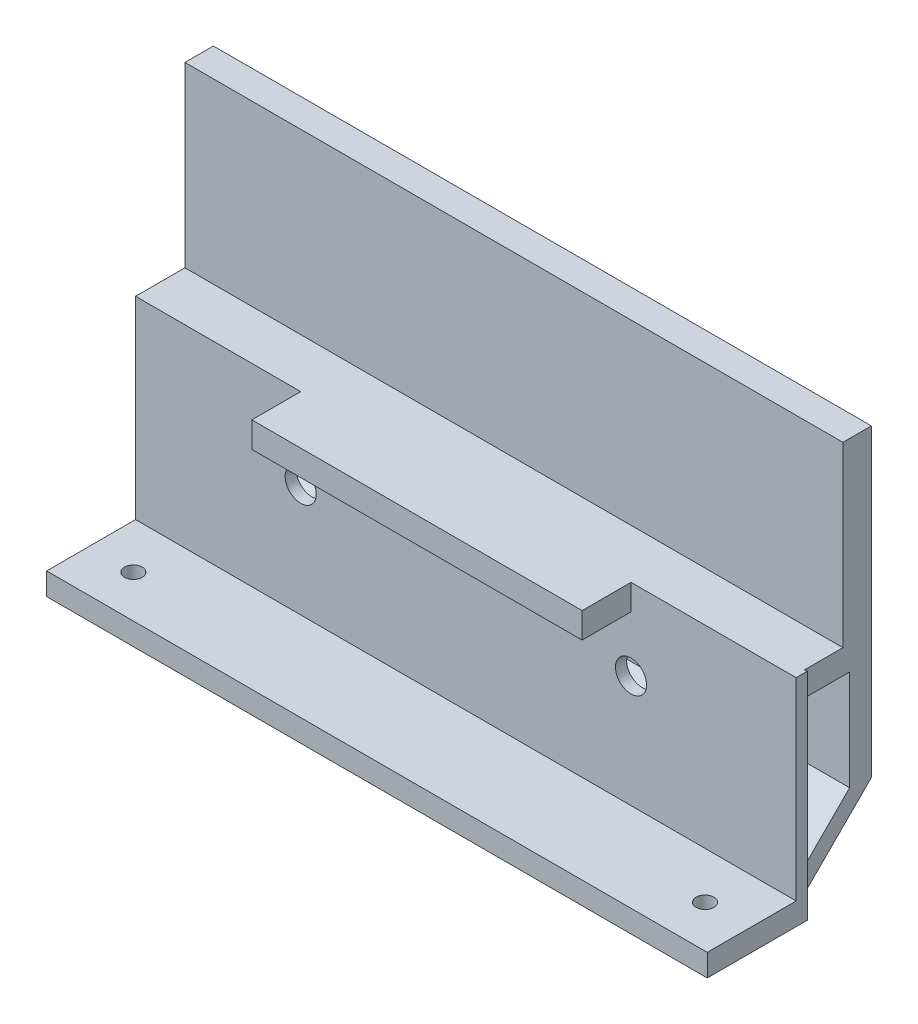
from build123d import *

# Parameters (mm, degrees)
ESQUISSE1_W             = 148.59
ESQUISSE1_H             = 2.5
ESQUISSE1_H_2           = 20
BOSS_EXTRU_2_DEPTH      = 5
BOSS_EXTRU_4_DEPTH      = 0.001
BOSS_EXTRU_4_DEPTH_BACK = 2.5
ESQUISSE2_W             = 148.59
ESQUISSE2_H             = 43.5
ESQUISSE3_R             = 2
ENL_V_MAT_EXTRU_1_DEPTH = 5
BOSS_EXTRU_9_DEPTH      = 148
ENL_V_MAT_EXTRU_2_DEPTH = 148
ENL_V_MAT_EXTRU_3_DEPTH = 158
ESQUISSE7_W             = 74.295
ESQUISSE7_H             = 5.75
BOSS_EXTRU_10_DEPTH     = 11
ESQUISSE8_W             = 148
ESQUISSE8_H             = 6.4
BOSS_EXTRU_11_DEPTH     = 40


with BuildPart() as part:
    # Esquisse1 → Boss.-Extru.2 (new body)
    with BuildSketch(Plane(origin=(0, 0, 0), x_dir=(1, 0, 0), z_dir=(0, 1, 0))):
        with Locations((-5.161134174, 17.745562161)):
            Rectangle(ESQUISSE1_W, ESQUISSE1_H)
        with Locations((-5.161134174, 28.995562161)):
            Rectangle(ESQUISSE1_W, ESQUISSE1_H_2)
    extrude(amount=BOSS_EXTRU_2_DEPTH)

    # Esquisse2 → Boss.-Extru.4 (add, two sides: drawn at the far end of the back side and taken through both)
    with BuildSketch(Plane(origin=(0, 0, -38.995562161), x_dir=(-1, 0, 0), z_dir=(0, 0, -1)).offset(-BOSS_EXTRU_4_DEPTH_BACK)):
        with Locations((5.161134174, 26.75)):
            Rectangle(ESQUISSE2_W, ESQUISSE2_H)
    extrude(amount=BOSS_EXTRU_4_DEPTH + BOSS_EXTRU_4_DEPTH_BACK)

    # Esquisse3 → Enlèv. mat.-Extru.1 (cut)
    with BuildSketch(Plane.XZ):
        with Locations(Location((-69.456134174, -25.995562161, 0), (0, 0, 270))):
            Circle(ESQUISSE3_R)
        with Locations(Location((59.133865826, -25.995562161, 0), (0, 0, 270))):
            Circle(ESQUISSE3_R)
    extrude(amount=-ENL_V_MAT_EXTRU_1_DEPTH, mode=Mode.SUBTRACT)

    # Esquisse4 → Boss.-Extru.9 (add)
    with BuildSketch(Plane.ZY.offset(79.456134174)):
        Polygon((-38.996562161, 5), (-38.996562161, 48.5), (-53.996562161, 48.5), (-53.996562161, 20), align=None)
    extrude(amount=-BOSS_EXTRU_9_DEPTH)

    # Esquisse5 → Enlèv. mat.-Extru.2 (cut)
    with BuildSketch(Plane.XY.offset(-36.495562161)):
        with BuildLine():
            ThreePointArc((31.986365826, 33.75), (28.486365826, 30.25), (31.986365826, 26.75))
            Line((31.986365826, 26.75), (31.986365826, 33.75))
        make_face()
        with BuildLine():
            Line((31.986365826, 33.75), (31.986365826, 26.75))
            ThreePointArc((31.986365826, 26.75), (34.46123956, 27.775126266), (35.486365826, 30.25))
            ThreePointArc((35.486365826, 30.25), (34.46123956, 32.724873734), (31.986365826, 33.75))
        make_face()
        with BuildLine():
            ThreePointArc((-38.808634174, 30.25), (-39.83376044, 32.724873734), (-42.308634174, 33.75))
            Line((-42.308634174, 33.75), (-42.308634174, 26.75))
            ThreePointArc((-42.308634174, 26.75), (-39.83376044, 27.775126266), (-38.808634174, 30.25))
        make_face()
        with BuildLine():
            Line((-42.308634174, 26.75), (-42.308634174, 33.75))
            ThreePointArc((-42.308634174, 33.75), (-45.808634174, 30.25), (-42.308634174, 26.75))
        make_face()
    extrude(amount=-ENL_V_MAT_EXTRU_2_DEPTH, mode=Mode.SUBTRACT)

    # Esquisse6 → Enlèv. mat.-Extru.3 (cut)
    with BuildSketch(Plane(origin=(68.543865826, 0, 0), x_dir=(0, 0, -1), z_dir=(1, 0, 0))):
        Polygon((38.996562161, 43.015232444), (49.10993279, 43.015232444), (49.10993279, 20.45031737), (38.996562161, 10.336946741), align=None)
    extrude(amount=-ENL_V_MAT_EXTRU_3_DEPTH, mode=Mode.SUBTRACT)

    # Esquisse7 → Boss.-Extru.10 (add)
    with BuildSketch(Plane.XY.offset(-36.495562161)):
        with Locations((-5.161134174, 45.625)):
            Rectangle(ESQUISSE7_W, ESQUISSE7_H)
    extrude(amount=BOSS_EXTRU_10_DEPTH)

    # Esquisse8 → Boss.-Extru.11 (add)
    with BuildSketch(Plane(origin=(0, 48.5, 0), x_dir=(1, 0, 0), z_dir=(0, 1, 0))):
        with Locations((-5.456134174, 50.796562161)):
            Rectangle(ESQUISSE8_W, ESQUISSE8_H)
    extrude(amount=BOSS_EXTRU_11_DEPTH)


solid = part.part
